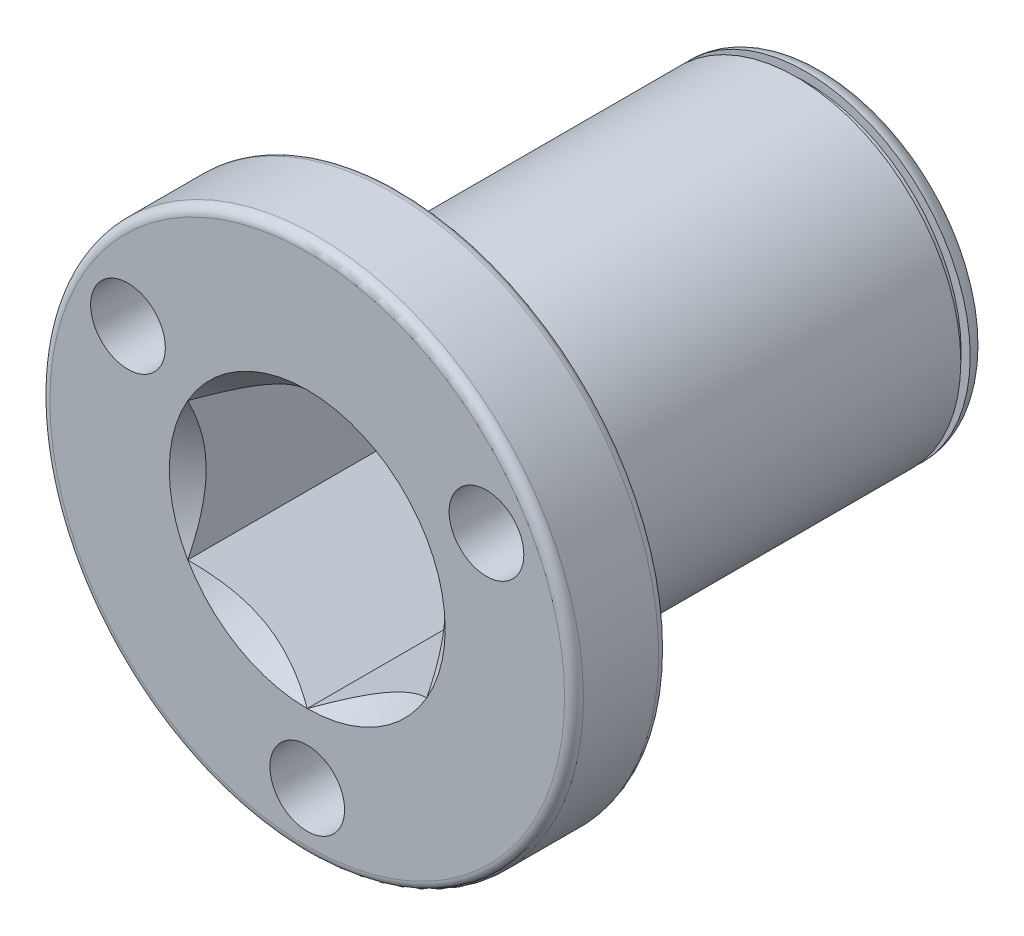
from build123d import *

# Parameters (mm, degrees)
SKETCH2_R          = 3.96875
CUT_EXTRUDE1_DEPTH = 69.062067304


with BuildPart() as part:
    # Sketch1 → Revolve1 (revolve)
    with BuildSketch(Plane(origin=(0, 0, 0), x_dir=(0, 0, -1), z_dir=(1, 0, 0)), mode=Mode.PRIVATE) as revolve1_sk:
        with BuildLine():
            Line((0, 27.35), (0, 0))
            Line((0, 0), (55, 0))
            Line((55, 0), (55, 15.4625))
            ThreePointArc((55, 15.4625), (54.414213562, 16.876713562), (53, 17.4625))
            Line((53, 17.4625), (53, 16.5))
            Line((53, 16.5), (52, 16.5))
            Line((52, 16.5), (52, 17.4625))
            Line((52, 17.4625), (11, 17.4625))
            ThreePointArc((11, 17.4625), (10.292893219, 17.755393219), (10, 18.4625))
            Line((10, 18.4625), (10, 27.35))
            ThreePointArc((10, 27.35), (9.707106781, 28.057106781), (9, 28.35))
            Line((9, 28.35), (1, 28.35))
            ThreePointArc((1, 28.35), (0.292893219, 28.057106781), (0, 27.35))
        make_face()
    revolve(revolve1_sk.sketch.rotate(Axis((0, 0, 0), (0, 0, -1)), 90), axis=Axis((0, 0, 0), (0, 0, -1)))

    # Sketch2 → Cut-Extrude1 (cut, through all)
    with BuildSketch(Plane.XY):
        Polygon((0, 14.664696837), (-12.7, 7.332348419), (-12.7, -7.332348419), (0, -14.664696837), (12.7, -7.332348419), (12.7, 7.332348419), align=None)
        with Locations((-19.05, 10.998522628)):
            Circle(SKETCH2_R)
        with Locations((19.05, 10.998522628)):
            Circle(SKETCH2_R)
        with Locations((0, -21.997045256)):
            Circle(SKETCH2_R)
    extrude(amount=-CUT_EXTRUDE1_DEPTH, mode=Mode.SUBTRACT)

    # Sketch3 → Cut-Revolve2 (revolve, cut)
    with BuildSketch(Plane(origin=(0, 0, 0), x_dir=(0, 0, -1), z_dir=(1, 0, 0))):
        Polygon((0, 14.664696837), (0, 11.164696837), (3.5, 11.164696837), align=None)
        Polygon((51.5, 11.164696837), (55, 11.164696837), (55, 14.664696837), align=None)
    revolve(axis=Axis((0, 0, -55), (0, 0, 1)), mode=Mode.SUBTRACT)


solid = part.part
